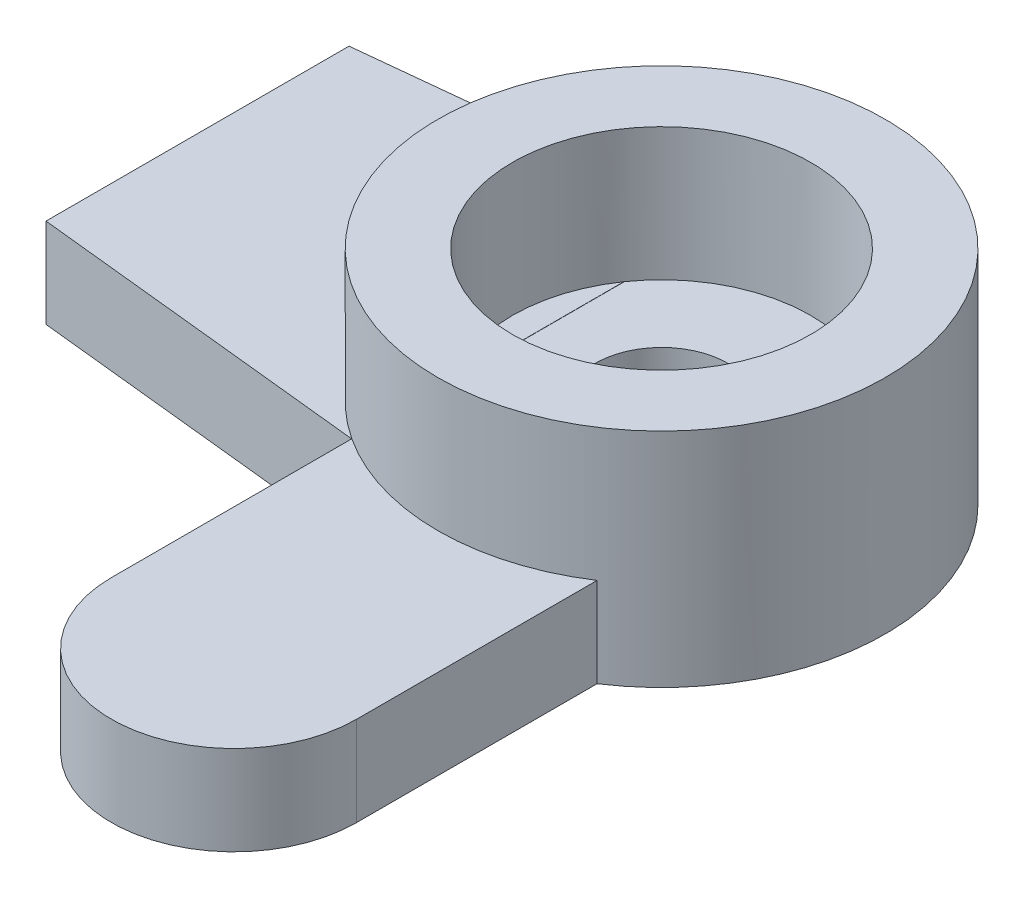
from build123d import *

# Parameters (mm, degrees)
ESTRUSIONE_ESTRUSIONE1_DEPTH   = 1.35
ESTRUSIONE_ESTRUSIONE1_2_DEPTH = 1.35
SCHIZZO2_R                     = 3.375
ESTRUSIONE_ESTRUSIONE2_DEPTH   = 2
SCHIZZO4_R                     = 2.25
TAGLIO_ESTRUSIONE1_DEPTH       = 2
SCHIZZO5_R                     = 1
TAGLIO_ESTRUSIONE2_DEPTH       = 12.040380428


with BuildPart() as part:
    # Schizzo1 → Estrusione-Estrusione1 (new body)
    with BuildSketch(Plane(origin=(0, 0, 0), x_dir=(1, 0, 0), z_dir=(0, 1, 0))):
        Polygon((-1.85, 2.824645909), (-7, 2.285363187), (-7, -2.285363187), (-1.85, -2.824645909), align=None)
    extrude(amount=ESTRUSIONE_ESTRUSIONE1_DEPTH)


with BuildPart() as body_2:
    # Schizzo1 → Estrusione-Estrusione1 2 (new body)
    with BuildSketch(Plane(origin=(0, 0, 0), x_dir=(1, 0, 0), z_dir=(0, 1, 0))):
        with BuildLine():
            Line((-1.846618531, 2.825), (-1.846618531, -2.825))
            Line((-1.846618531, -2.825), (-1.85, -2.824645909))
            Line((-1.85, -2.824645909), (-1.85, -6.45))
            ThreePointArc((-1.85, -6.45), (0, -8.3), (1.85, -6.45))
            Line((1.85, -6.45), (1.85, -2.822786744))
            ThreePointArc((1.85, -2.822786744), (2.823893878, 1.848309597), (-1.846618531, 2.825))
        make_face()
    extrude(amount=ESTRUSIONE_ESTRUSIONE1_2_DEPTH)

    # Schizzo2 → Estrusione-Estrusione2 (add)
    with BuildSketch(Plane(origin=(0, 1.35, 0), x_dir=(1, 0, 0), z_dir=(0, 1, 0))):
        with Locations(Location((0, 0, 0), (0, 0, 123.171451951))):
            Circle(SCHIZZO2_R)
    extrude(amount=ESTRUSIONE_ESTRUSIONE2_DEPTH)

    # Schizzo4 → Taglio-Estrusione1 (cut)
    with BuildSketch(Plane(origin=(0, 3.35, 0), x_dir=(1, 0, 0), z_dir=(0, 1, 0))):
        with Locations(Location((0, 0, 0), (0, 0, 270))):
            Circle(SCHIZZO4_R)
    extrude(amount=-TAGLIO_ESTRUSIONE1_DEPTH, mode=Mode.SUBTRACT)

    # Schizzo5 → Taglio-Estrusione2 (cut, through all)
    with BuildSketch(Plane(origin=(0, 1.35, 0), x_dir=(1, 0, 0), z_dir=(0, 1, 0))):
        with Locations(Location((0, 0, 0), (0, 0, 270))):
            Circle(SCHIZZO5_R)
    extrude(amount=-TAGLIO_ESTRUSIONE2_DEPTH, mode=Mode.SUBTRACT)


solid = Compound([part.part, body_2.part])
